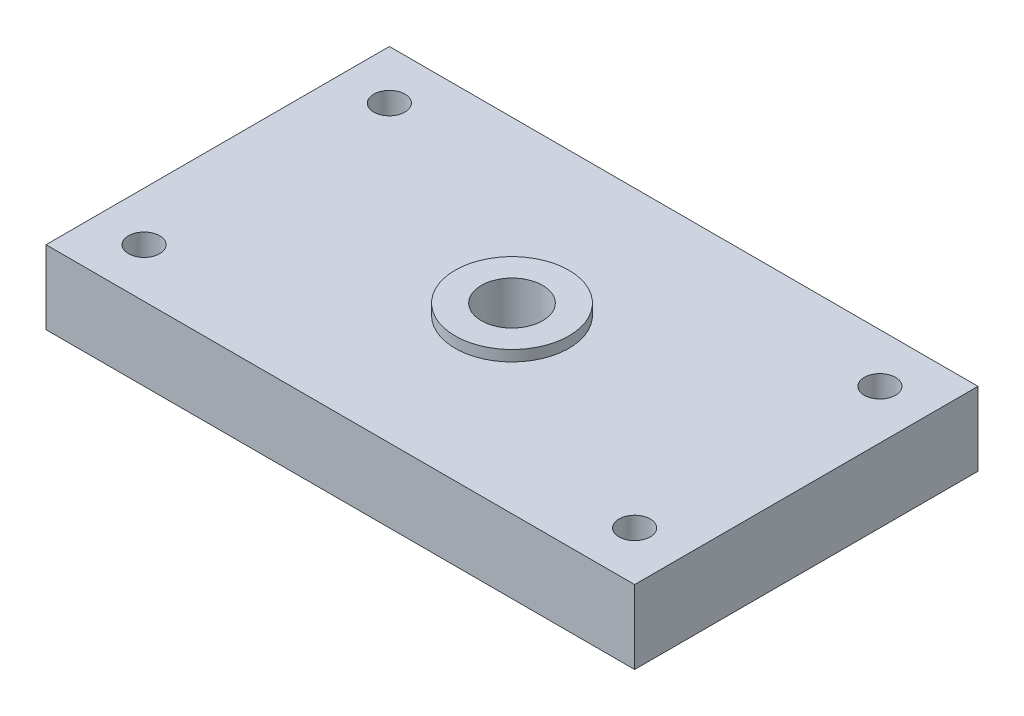
from build123d import *

# Parameters (mm, degrees)
SKETCH1_W               = 76.2
SKETCH1_H               = 44.45
BOSS_EXTRUDE1_DEPTH     = 9.525
F_10_32_TAPPED_HOLE1_D  = 4.0386
SKETCH9_R               = 7.366
BOSS_EXTRUDE2_DEPTH     = 1.397
F_3_8_16_TAPPED_HOLE1_D = 7.9375


with BuildPart() as part:
    # Sketch1 → Boss-Extrude1 (new body)
    with BuildSketch(Plane(origin=(0, 0, 0), x_dir=(1, 0, 0), z_dir=(0, 1, 0))):
        with Locations((38.1, 22.225)):
            Rectangle(SKETCH1_W, SKETCH1_H)
    extrude(amount=BOSS_EXTRUDE1_DEPTH)

    # #10-32 Tapped Hole1 (through all)
    with Locations(Plane(origin=(0, 9.525, 0), x_dir=(-1, 0, 0), z_dir=(0, 1, 0))):
        with Locations((-6.35, -38.1), (-69.85, -38.1), (-69.85, -6.35), (-6.35, -6.35)):
            Hole(F_10_32_TAPPED_HOLE1_D / 2)

    # Sketch9 → Boss-Extrude2 (add)
    with BuildSketch(Plane(origin=(0, 9.525, 0), x_dir=(1, 0, 0), z_dir=(0, 1, 0))):
        with Locations(Location((38.1, 22.225, 0), (0, 0, 90))):
            Circle(SKETCH9_R)
    extrude(amount=BOSS_EXTRUDE2_DEPTH)

    # 3/8-16 Tapped Hole1 (through all)
    with Locations(Plane(origin=(0, 10.922, 0), x_dir=(-1, 0, 0), z_dir=(0, 1, 0))):
        with Locations((-38.1, -22.225)):
            Hole(F_3_8_16_TAPPED_HOLE1_D / 2)


solid = part.part
